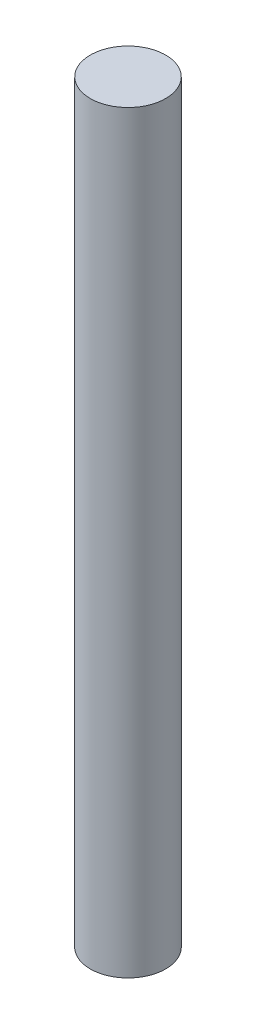
from build123d import *

# Parameters (mm, degrees)
SKETCH1_R           = 8.5
BOSS_EXTRUDE1_DEPTH = 170


with BuildPart() as part:
    # Sketch1 → Boss-Extrude1 (new body)
    with BuildSketch(Plane(origin=(0, 0, 0), x_dir=(1, 0, 0), z_dir=(0, 1, 0))):
        with Locations(Location((0, 0, 0), (0, 0, 270))):
            Circle(SKETCH1_R)
    extrude(amount=BOSS_EXTRUDE1_DEPTH)


solid = part.part
